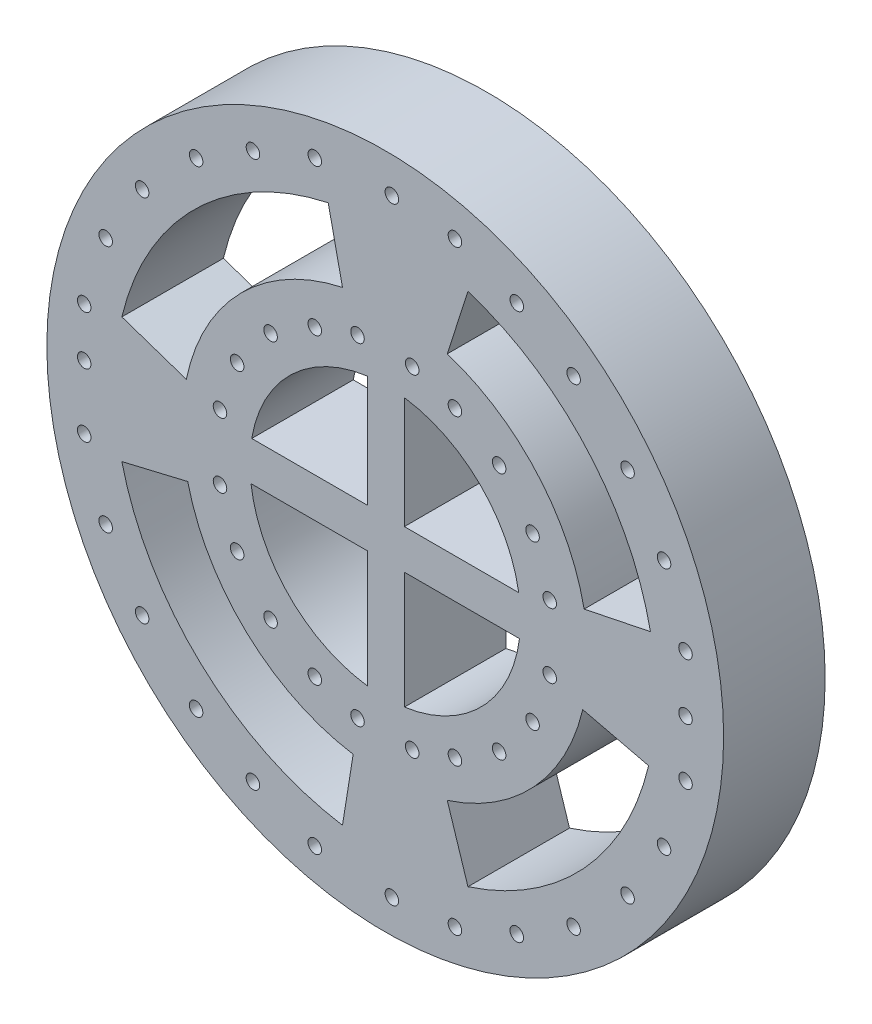
from build123d import *

# Parameters (mm, degrees)
SKETCH1_R           = 127
BOSS_EXTRUDE1_DEPTH = 38.1
SKETCH2_R           = 121.825159098
SKETCH2_R_2         = 55.948426771
CUT_EXTRUDE1_DEPTH  = 31.75
SKETCH4_R           = 2.54
CUT_EXTRUDE3_DEPTH  = 25.4


with BuildPart() as part:
    # Sketch1 → Boss-Extrude1 (new body)
    with BuildSketch(Plane.XY):
        with Locations(Location((-33.762487444, 46.957799842, 0), (0, 0, 180))):
            Circle(SKETCH1_R)
        with BuildLine():
            Line((-26.585000486, -3.332593683), (-26.585000486, 40.517010102))
            Line((-26.585000486, 40.517010102), (16.627553511, 40.517010102))
            ThreePointArc((16.627553511, 40.517010102), (2.420409144, 11.300570639), (-26.585000486, -3.332593683))
        make_face(mode=Mode.SUBTRACT)
        with BuildLine():
            Line((-40.39467032, -3.407407894), (-40.39467032, 40.517010102))
            Line((-40.39467032, 40.517010102), (-84.1525284, 40.517010102))
            ThreePointArc((-84.1525284, 40.517010102), (-69.751682027, 11.105075075), (-40.39467032, -3.407407894))
        make_face(mode=Mode.SUBTRACT)
        with BuildLine():
            Line((65.080698845, 23.450683386), (40.369902273, 29.3274625))
            ThreePointArc((40.369902273, 29.3274625), (22.152677736, -4.81028205), (-10.482872263, -25.599071073))
            Line((-10.482872263, -25.599071073), (-2.723000536, -49.784694711))
            ThreePointArc((-2.723000536, -49.784694711), (40.79106613, -22.066309347), (65.080698845, 23.450683386))
        make_face(mode=Mode.SUBTRACT)
        with BuildLine():
            Line((65.768603115, 67.356868745), (40.885830475, 62.25710152))
            ThreePointArc((40.885830475, 62.25710152), (22.956797892, 97.843580478), (-10.482872263, 119.514670757))
            Line((-10.482872263, 119.514670757), (-2.723000536, 143.700294396))
            ThreePointArc((-2.723000536, 143.700294396), (41.863226338, 114.805507356), (65.768603115, 67.356868745))
        make_face(mode=Mode.SUBTRACT)
        with BuildLine():
            Line((-107.894877162, 29.3274625), (-132.605673734, 23.450683386))
            ThreePointArc((-132.605673734, 23.450683386), (-102.864783632, -27.523289446), (-49.80854646, -53.367092333))
            Line((-49.80854646, -53.367092333), (-45.797031706, -28.28586929))
            ThreePointArc((-45.797031706, -28.28586929), (-85.589209585, -8.903017124), (-107.894877162, 29.3274625))
        make_face(mode=Mode.SUBTRACT)
        with BuildLine():
            Line((16.34326948, 55.327574216), (-26.585000486, 55.327574216))
            Line((-26.585000486, 55.327574216), (-26.585000486, 97.248193368))
            ThreePointArc((-26.585000486, 97.248193368), (1.729442412, 83.302853358), (16.34326948, 55.327574216))
        make_face(mode=Mode.SUBTRACT)
        with BuildLine():
            Line((-108.410805364, 62.25710152), (-132.605673734, 70.464916298))
            ThreePointArc((-132.605673734, 70.464916298), (-104.834687001, 119.561535628), (-55.157232799, 146.27962459))
            Line((-55.157232799, 146.27962459), (-49.80854646, 121.449168403))
            ThreePointArc((-49.80854646, 121.449168403), (-87.913135616, 100.568874282), (-108.410805364, 62.25710152))
        make_face(mode=Mode.SUBTRACT)
        with BuildLine():
            Line((-40.39467032, 55.327574216), (-83.868244368, 55.327574216))
            ThreePointArc((-83.868244368, 55.327574216), (-69.056999185, 83.494595556), (-40.39467032, 97.323007578))
            Line((-40.39467032, 97.323007578), (-40.39467032, 55.327574216))
        make_face(mode=Mode.SUBTRACT)
    extrude(amount=BOSS_EXTRUDE1_DEPTH)

    # Sketch2 → Cut-Extrude1 (cut)
    with BuildSketch(Plane(origin=(0, 0, 0), x_dir=(-1, 0, 0), z_dir=(0, 0, -1))):
        with Locations((33.762487444, 46.957799842)):
            Circle(SKETCH2_R)
        with Locations((33.762487444, 46.957799842)):
            Circle(SKETCH2_R_2, mode=Mode.SUBTRACT)
        with BuildLine():
            Line((138.519360461, 26.640882165), (103.545749119, 33.423787783))
            ThreePointArc((103.545749119, 33.423787783), (82.09047925, -5.169719765), (41.986549655, -23.648417258))
            Line((41.986549655, -23.648417258), (46.108242286, -59.03447311))
            ThreePointArc((46.108242286, -59.03447311), (106.311250274, -31.294718328), (138.519360461, 26.640882165))
        make_face(mode=Mode.SUBTRACT)
        with BuildLine():
            Line((138.519360461, 67.274717519), (104.257428362, 56.086676957))
            ThreePointArc((104.257428362, 56.086676957), (85.1635344, 96.057753653), (46.108242286, 116.961052837))
            Line((46.108242286, 116.961052837), (52.295623345, 152.044918281))
            ThreePointArc((52.295623345, 152.044918281), (108.572936641, 123.051007681), (138.519360461, 67.274717519))
        make_face(mode=Mode.SUBTRACT)
        with BuildLine():
            Line((4.921540725, -55.779629464), (14.550236506, -21.480219608))
            ThreePointArc((14.550236506, -21.480219608), (-18.521954058, -1.200379828), (-36.02077423, 33.423787783))
            Line((-36.02077423, 33.423787783), (-70.994385572, 26.640882165))
            ThreePointArc((-70.994385572, 26.640882165), (-44.725597918, -25.336045292), (4.921540725, -55.779629464))
        make_face(mode=Mode.SUBTRACT)
        with BuildLine():
            Line((-71.448904325, 64.771913071), (-36.323549601, 58.824581363))
            ThreePointArc((-36.323549601, 58.824581363), (-19.092240815, 94.489376641), (14.550236506, 115.395819293))
            Line((14.550236506, 115.395819293), (4.921540725, 149.695229149))
            ThreePointArc((4.921540725, 149.695229149), (-45.58169802, 118.311004544), (-71.448904325, 64.771913071))
        make_face(mode=Mode.SUBTRACT)
    extrude(amount=-CUT_EXTRUDE1_DEPTH, mode=Mode.SUBTRACT)

    # Sketch4 → Cut-Extrude3 (cut)
    with BuildSketch(Plane(origin=(0, 0, 31.75), x_dir=(-1, 0, 0), z_dir=(0, 0, -1))):
        with Locations((31.281297081, -67.505404389)):
            Circle(SKETCH4_R)
        with Locations((60.205260923, -65.29342847)):
            Circle(SKETCH4_R)
        with Locations((83.413284725, -56.002203895)):
            Circle(SKETCH4_R)
        with Locations((104.747838674, -42.951403951)):
            Circle(SKETCH4_R)
        with Locations((124.996169025, -22.689001677)):
            Circle(SKETCH4_R)
        with Locations((138.681871495, 0)):
            Circle(SKETCH4_R)
        with Locations((146.743625587, 25.43589811)):
            Circle(SKETCH4_R)
        with Locations((146.743625587, 49.259285421)):
            Circle(SKETCH4_R)
        with Locations(Location((-27.958558869, 34.347513636, 0), (0, 0, 180))):
            Circle(SKETCH4_R)
        with Locations((44.169136825, -15.737345855)):
            Circle(SKETCH4_R)
        with Locations((60.205260923, -10.25450455)):
            Circle(SKETCH4_R)
        with Locations((76.793334998, 0)):
            Circle(SKETCH4_R)
        with Locations((89.338680519, 15.902012931)):
            Circle(SKETCH4_R)
        with Locations((95.775347578, 34.347513636)):
            Circle(SKETCH4_R)
        with Locations(Location((-21.52189181, 15.902012931, 0), (0, 0, 180))):
            Circle(SKETCH4_R)
        with Locations(Location((-8.976546288, 0, 0), (0, 0, 180))):
            Circle(SKETCH4_R)
        with Locations(Location((7.611527786, -10.25450455, 0), (0, 0, 180))):
            Circle(SKETCH4_R)
        with Locations(Location((23.647651884, -15.737345855, 0), (0, 0, 180))):
            Circle(SKETCH4_R)
        with Locations(Location((-78.926836877, 46.526134027, 0), (0, 0, 180))):
            Circle(SKETCH4_R)
        with Locations(Location((-78.926836877, 25.43589811, 0), (0, 0, 180))):
            Circle(SKETCH4_R)
        with Locations(Location((-70.865082786, 0, 0), (0, 0, 180))):
            Circle(SKETCH4_R)
        with Locations(Location((-57.179380316, -22.689001677, 0), (0, 0, 180))):
            Circle(SKETCH4_R)
        with Locations(Location((-36.931049965, -42.951403951, 0), (0, 0, 180))):
            Circle(SKETCH4_R)
        with Locations(Location((-15.596496015, -56.002203895, 0), (0, 0, 180))):
            Circle(SKETCH4_R)
        with Locations(Location((7.611527786, -65.29342847, 0), (0, 0, 180))):
            Circle(SKETCH4_R)
        with Locations(Location((95.775347578, 58.704754417, 0), (0, 0, 180))):
            Circle(SKETCH4_R)
        with Locations((-27.958558869, 58.704754417)):
            Circle(SKETCH4_R)
        with Locations((-78.926836877, 67.616369944)):
            Circle(SKETCH4_R)
        with Locations((7.611527786, 158.345696523)):
            Circle(SKETCH4_R)
        with Locations((-15.596496015, 149.054471948)):
            Circle(SKETCH4_R)
        with Locations((-36.931049965, 136.003672004)):
            Circle(SKETCH4_R)
        with Locations((-57.179380316, 115.74126973)):
            Circle(SKETCH4_R)
        with Locations((-70.865082786, 93.052268053)):
            Circle(SKETCH4_R)
        with Locations((23.647651884, 108.789613908)):
            Circle(SKETCH4_R)
        with Locations((7.611527786, 103.306772603)):
            Circle(SKETCH4_R)
        with Locations((-8.976546288, 93.052268053)):
            Circle(SKETCH4_R)
        with Locations((-21.52189181, 77.150255122)):
            Circle(SKETCH4_R)
        with Locations(Location((89.338680519, 77.150255122, 0), (0, 0, 180))):
            Circle(SKETCH4_R)
        with Locations(Location((76.793334998, 93.052268053, 0), (0, 0, 180))):
            Circle(SKETCH4_R)
        with Locations(Location((60.205260923, 103.306772603, 0), (0, 0, 180))):
            Circle(SKETCH4_R)
        with Locations(Location((44.169136825, 108.789613908, 0), (0, 0, 180))):
            Circle(SKETCH4_R)
        with Locations(Location((146.743625587, 67.616369944, 0), (0, 0, 180))):
            Circle(SKETCH4_R)
        with Locations(Location((138.681871495, 93.052268053, 0), (0, 0, 180))):
            Circle(SKETCH4_R)
        with Locations(Location((124.996169025, 115.74126973, 0), (0, 0, 180))):
            Circle(SKETCH4_R)
        with Locations(Location((104.747838674, 136.003672004, 0), (0, 0, 180))):
            Circle(SKETCH4_R)
        with Locations(Location((83.413284725, 149.054471948, 0), (0, 0, 180))):
            Circle(SKETCH4_R)
        with Locations(Location((60.205260923, 158.345696523, 0), (0, 0, 180))):
            Circle(SKETCH4_R)
        with Locations(Location((31.281297081, 160.557672442, 0), (0, 0, 180))):
            Circle(SKETCH4_R)
    extrude(amount=-CUT_EXTRUDE3_DEPTH, mode=Mode.SUBTRACT)


solid = part.part
